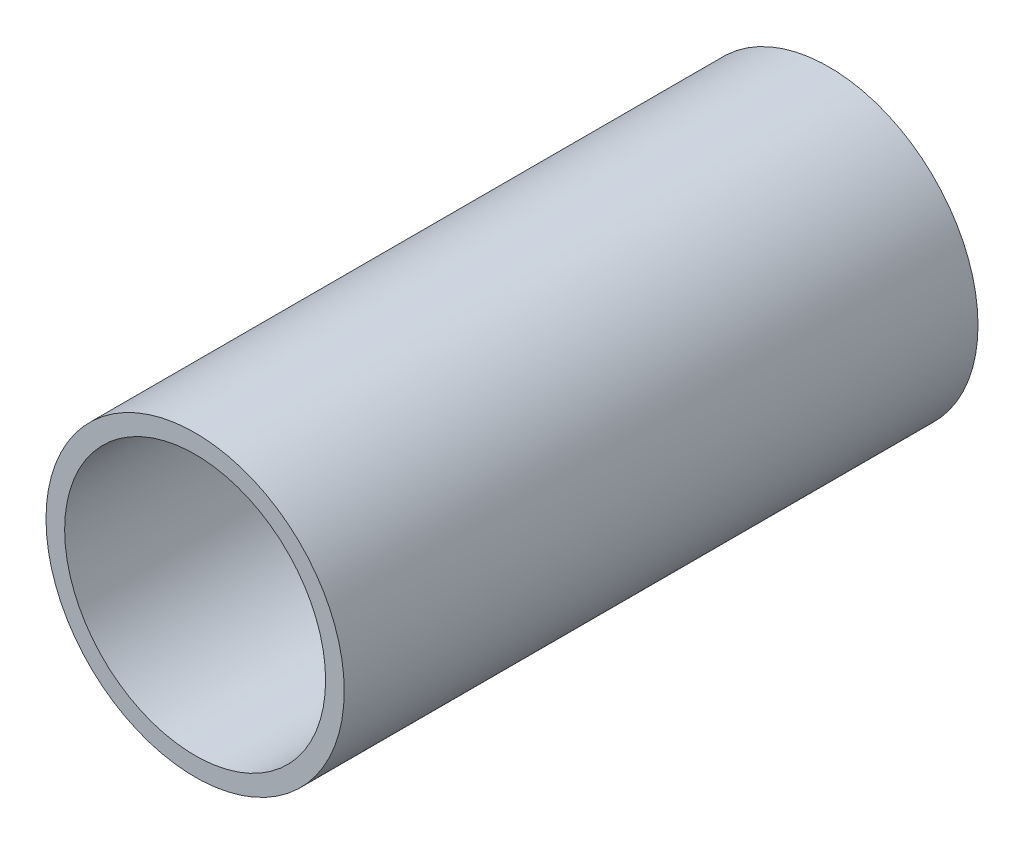
from build123d import *

# Parameters (mm, degrees)
ESBO_O1_R                = 4
RESSALTO_EXTRUS_O1_DEPTH = 17
ESBO_O2_R                = 3.5
CORTE_EXTRUS_O1_DEPTH    = 15


with BuildPart() as part:
    # Esboço1 → Ressalto-extrusão1 (new body)
    with BuildSketch(Plane.XY):
        Circle(ESBO_O1_R)
    extrude(amount=RESSALTO_EXTRUS_O1_DEPTH)

    # Esboço2 → Corte-extrusão1 (cut)
    with BuildSketch(Plane.XY.offset(17)):
        Circle(ESBO_O2_R)
    extrude(amount=-CORTE_EXTRUS_O1_DEPTH, mode=Mode.SUBTRACT)


solid = part.part
